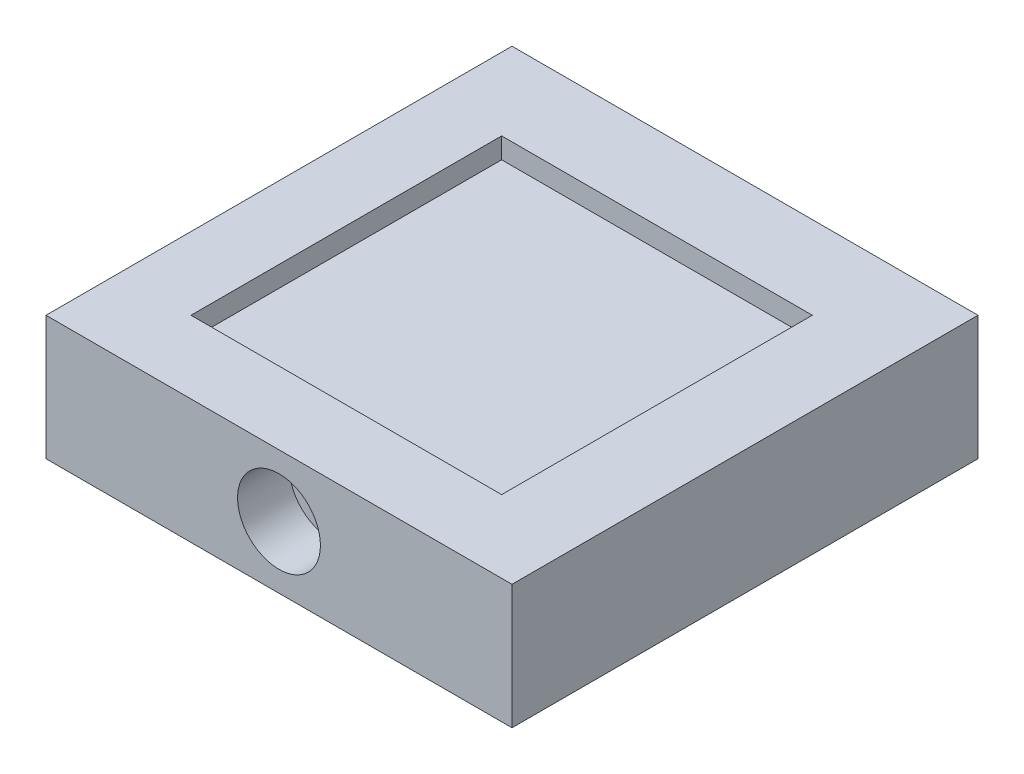
from build123d import *

# Parameters (mm, degrees)
SKETCH_1_W          = 45
SKETCH_1_H          = 45
EXTRUDE_1_DEPTH     = 12
SKETCH_2_R          = 4
CUT_EXTRUDE_1_DEPTH = 5
SKETCH_3_R          = 4
CUT_EXTRUDE_2_DEPTH = 5
SKETCH_4_W          = 30
SKETCH_4_H          = 30
CUT_EXTRUDE_3_DEPTH = 2


with BuildPart() as part:
    # 草图1 → 凸台-拉伸1 (new body)
    with BuildSketch(Plane(origin=(0, 0, 0), x_dir=(1, 0, 0), z_dir=(0, 1, 0))):
        with Locations((22.5, 22.5)):
            Rectangle(SKETCH_1_W, SKETCH_1_H)
    extrude(amount=EXTRUDE_1_DEPTH)

    # 草图2 → 切除-拉伸1 (cut)
    with BuildSketch(Plane.XY):
        with Locations((22.5, 6)):
            Circle(SKETCH_2_R)
    extrude(amount=-CUT_EXTRUDE_1_DEPTH, mode=Mode.SUBTRACT)

    # 草图3 → 切除-拉伸2 (cut)
    with BuildSketch(Plane.ZY):
        with Locations((-22.477885381, 6)):
            Circle(SKETCH_3_R)
    extrude(amount=-CUT_EXTRUDE_2_DEPTH, mode=Mode.SUBTRACT)

    # 草图4 → 切除-拉伸3 (cut)
    with BuildSketch(Plane(origin=(0, 12, 0), x_dir=(1, 0, 0), z_dir=(0, 1, 0))):
        with Locations((22, 22)):
            Rectangle(SKETCH_4_W, SKETCH_4_H)
    extrude(amount=-CUT_EXTRUDE_3_DEPTH, mode=Mode.SUBTRACT)


solid = part.part
